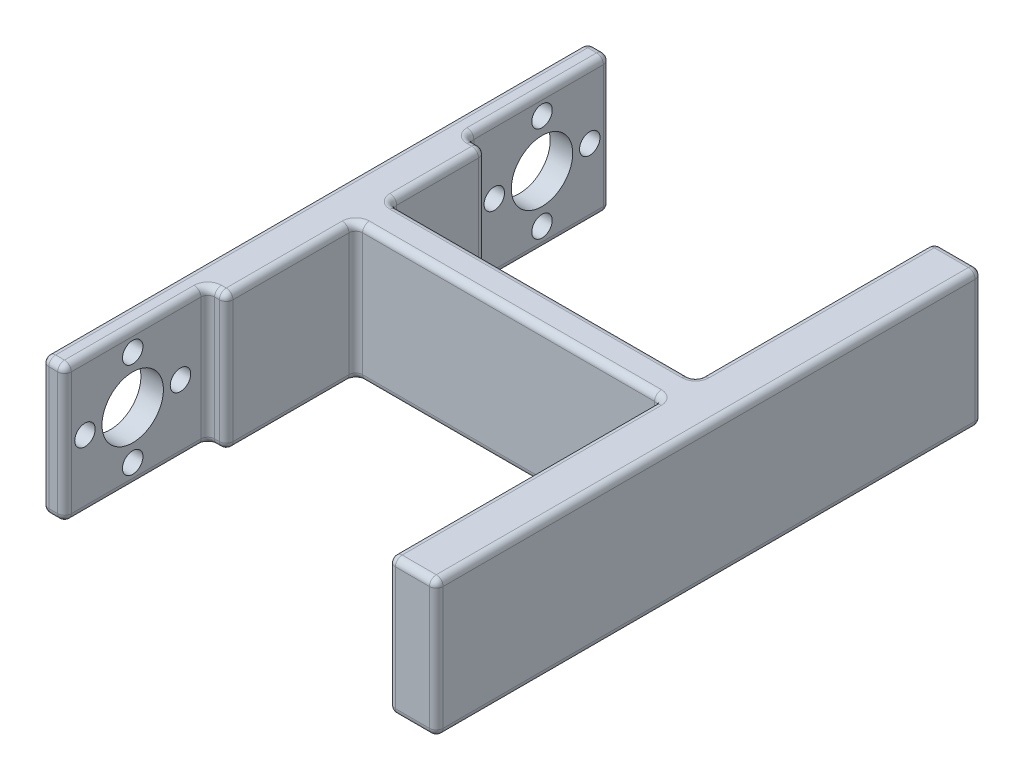
from build123d import *

# Parameters (mm, degrees)
BOSS_EXTRUDE1_DEPTH = 20
SKETCH4_R           = 1.5
SKETCH4_R_2         = 4.5
CUT_EXTRUDE1_DEPTH  = 10
CUT_EXTRUDE2_START  = -3.3
SKETCH5_W           = 21
SKETCH5_H           = 20
CUT_EXTRUDE2_DEPTH  = 2.7
FILLET1_R           = 1
SKETCH3_R           = 8.1
CUT_EXTRUDE3_DEPTH  = 5


with BuildPart() as part:
    # Sketch2 → Boss-Extrude1 (new body)
    with BuildSketch(Plane(origin=(0, 0, 0), x_dir=(1, 0, 0), z_dir=(0, 1, 0))):
        Polygon((0, 0), (0, -80), (6, -80), (6, -40), (50.8, -40), (50.8, -80), (57.8, -80), (57.8, 0), (50.8, 0), (50.8, -35), (6, -35), (6, 0), align=None)
    extrude(amount=BOSS_EXTRUDE1_DEPTH)

    # Sketch4 → Cut-Extrude1 (cut)
    with BuildSketch(Plane.ZY):
        with Locations((70, 17)):
            Circle(SKETCH4_R)
        with Locations((77, 10)):
            Circle(SKETCH4_R)
        with Locations((70, 3)):
            Circle(SKETCH4_R)
        with Locations((63, 10)):
            Circle(SKETCH4_R)
        with Locations((70, 10)):
            Circle(SKETCH4_R_2)
    cut_extrude1 = extrude(amount=-CUT_EXTRUDE1_DEPTH, mode=Mode.SUBTRACT)

    # Sketch5 → Cut-Extrude2 (cut)
    with BuildSketch(Plane.ZY.offset(CUT_EXTRUDE2_START)):
        with Locations((69.5, 10)):
            Rectangle(SKETCH5_W, SKETCH5_H)
    cut_extrude2 = extrude(amount=-CUT_EXTRUDE2_DEPTH, mode=Mode.SUBTRACT)

    # Mirror1: Cut-Extrude1, Cut-Extrude2 across plane
    add(cut_extrude1.mirror(Plane.XY.offset(40)), mode=Mode.SUBTRACT)
    add(cut_extrude2.mirror(Plane.XY.offset(40)), mode=Mode.SUBTRACT)

    # Fillet1
    fillet1_edges = [part.edges().sort_by_distance(p)[0] for p in [
        (1.65, 0, 0),
        (1.65, 20, 0),
        (3.3, 10, 21),
        (4.65, 20, 21),
        (3.3, 0, 10.5),
        (4.65, 0, 21),
        (3.3, 10, 0),
        (3.3, 20, 10.5),
        (6, 0, 28),
        (6, 10, 21),
        (28.4, 0, 35),
        (1.65, 20, 80),
        (50.8, 0, 17.5),
        (54.3, 0, 0),
        (57.8, 0, 40),
        (54.3, 0, 80),
        (50.8, 0, 60),
        (28.4, 0, 40),
        (1.65, 0, 80),
        (0, 0, 40),
        (6, 10, 35),
        (50.8, 10, 35),
        (28.4, 20, 40),
        (50.8, 10, 0),
        (57.8, 10, 0),
        (57.8, 10, 80),
        (50.8, 10, 80),
        (50.8, 10, 40),
        (6, 10, 40),
        (0, 10, 80),
        (0, 10, 0),
        (50.8, 20, 60),
        (54.3, 20, 80),
        (57.8, 20, 40),
        (54.3, 20, 0),
        (50.8, 20, 17.5),
        (28.4, 20, 35),
        (6, 20, 28),
        (6, 0, 49.5),
        (6, 20, 49.5),
        (3.3, 10, 59),
        (3.3, 0, 69.5),
        (3.3, 10, 80),
        (3.3, 20, 69.5),
        (6, 10, 59),
        (4.65, 0, 59),
        (4.65, 20, 59),
        (0, 20, 40),
    ]]
    fillet(fillet1_edges, radius=FILLET1_R)

    # Sketch3 → Cut-Extrude3 (cut)
    with BuildSketch(Plane.ZY.offset(-50.8)):
        with Locations((70, 10)):
            Circle(SKETCH3_R)
        with Locations(Location((10, 10, 0), (0, 0, 180))):
            Circle(SKETCH3_R)
    extrude(amount=-CUT_EXTRUDE3_DEPTH, mode=Mode.SUBTRACT)


solid = part.part
